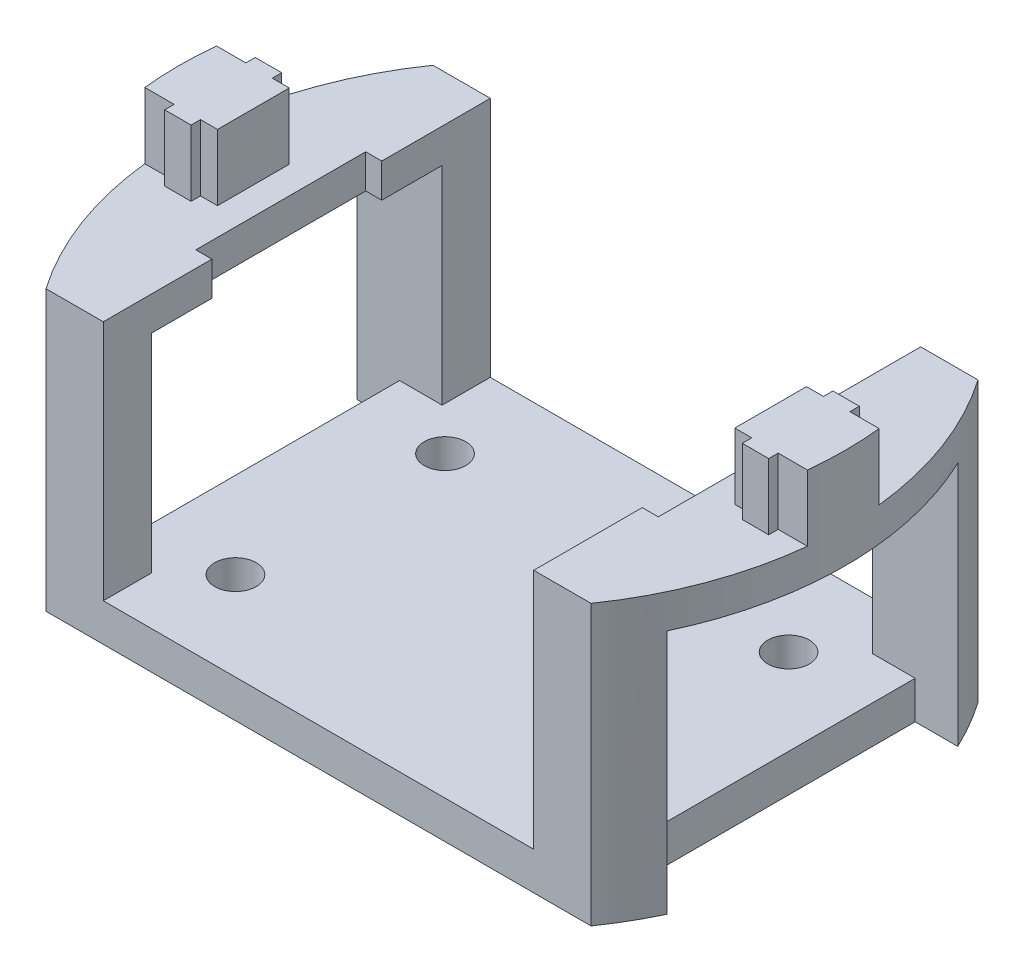
from build123d import *
from build123d.topology import SkipClean

# Parameters (mm, degrees)
SALIENTE_EXTRUIR1_DEPTH           = 14.8
CORTAR_EXTRUIR1_DEPTH             = 25.86366797
CORTAR_EXTRUIR1_DEPTH_BACK        = 25.86366797
CROQUIS2_W                        = 15.4
CROQUIS2_H                        = 11
CORTAR_EXTRUIR2_REACH             = 26.864
CORTAR_EXTRUIR2_DIRECTION_2_DEPTH = 25.86366797
SALIENTE_EXTRUIR2_DEPTH           = 3.5
CROQUIS5_R                        = 1.1
CORTAR_EXTRUIR3_DEPTH             = 26.784723868
CORTAR_EXTRUIR4_DEPTH             = 26.784723868
CROQUIS7_W                        = 27.231493877
CROQUIS7_H                        = 23.409529823
CORTAR_EXTRUIR5_DEPTH             = 28.093393751
CROQUIS8_W                        = 20.5
CROQUIS8_H                        = 2
SALIENTE_EXTRUIR3_DEPTH           = 0.5


with BuildPart() as part:
    # Croquis1 → Saliente-Extruir1 (new body)
    with BuildSketch(Plane(origin=(0, 0, 0), x_dir=(1, 0, 0), z_dir=(0, 1, 0))):
        with BuildLine():
            Line((-13.935, -10.25), (13.935, -10.25))
            ThreePointArc((13.935, -10.25), (17.149328994, 0), (13.935, 10.25))
            Line((13.935, 10.25), (-13.935, 10.25))
            ThreePointArc((-13.935, 10.25), (-17.149328994, 0), (-13.935, -10.25))
        make_face()
    extrude(amount=SALIENTE_EXTRUIR1_DEPTH)

    # Croquis2 → Cortar-Extruir1 (cut, two sides: drawn at the far end of the back side and taken through both)
    with BuildSketch(Plane(origin=(0, 0, 0), x_dir=(0, 0, -1), z_dir=(1, 0, 0)).offset(-CORTAR_EXTRUIR1_DEPTH_BACK)):
        with Locations((0, 7.5)):
            Rectangle(CROQUIS2_W, CROQUIS2_H)
    extrude(amount=CORTAR_EXTRUIR1_DEPTH + CORTAR_EXTRUIR1_DEPTH_BACK, mode=Mode.SUBTRACT)

    # Cortar-Extruir2: up to this face of the body (flat: up to its plane)
    cortar_extruir2_end = Plane(part.part.faces().sort_by_distance((0, 2, 0))[0])
    # Croquis3 → Cortar-Extruir2 (cut, up to the picked face)
    with BuildSketch(Plane(origin=(0, 14.8, 0), x_dir=(1, 0, 0), z_dir=(0, 1, 0)), mode=Mode.PRIVATE) as cortar_extruir2_sk1:
        Polygon((10.9, -10.25), (-10.9, -10.25), (-10.9, -4.5), (-11.75, -4.5), (-11.75, 4.5), (-10.9, 4.5), (-10.9, 10.25), (10.9, 10.25), (10.9, 4.5), (11.75, 4.5), (11.75, -4.5), (10.9, -4.5), align=None)
    cortar_extruir2_tool1 = split(extrude(cortar_extruir2_sk1.sketch, amount=-CORTAR_EXTRUIR2_REACH, mode=Mode.PRIVATE), bisect_by=cortar_extruir2_end, keep=Keep.BOTH, mode=Mode.PRIVATE)
    add(cortar_extruir2_tool1.solids().sort_by(Axis((0, 14.8, 0), (0, -1, 0)))[0], mode=Mode.SUBTRACT)

    # Croquis3 → Cortar-Extruir2 direction 2 (cut)
    with BuildSketch(Plane(origin=(0, 14.8, 0), x_dir=(1, 0, 0), z_dir=(0, 1, 0))):
        Polygon((10.9, -10.25), (-10.9, -10.25), (-10.9, -4.5), (-11.75, -4.5), (-11.75, 4.5), (-10.9, 4.5), (-10.9, 10.25), (10.9, 10.25), (10.9, 4.5), (11.75, 4.5), (11.75, -4.5), (10.9, -4.5), align=None)
    extrude(amount=CORTAR_EXTRUIR2_DIRECTION_2_DEPTH, mode=Mode.SUBTRACT)

    # Croquis4 → Saliente-Extruir2 (add)
    with SkipClean():  # the faces are left unmerged after this step: merging them gives an invalid solid
        with BuildSketch(Plane(origin=(0, 14.8, 0), x_dir=(1, 0, 0), z_dir=(0, 1, 0))):
            with BuildLine():
                Line((-13.2, 1.9), (-13.2, -1.9))
                Line((-13.2, -1.9), (-14.1, -1.9))
                Line((-14.1, -1.9), (-14.1, -2.4))
                Line((-14.1, -2.4), (-15.5, -2.4))
                Line((-15.5, -2.4), (-15.5, -1.9))
                Line((-15.5, -1.9), (-17.048488638, -1.9))
                ThreePointArc((-17.048488638, -1.9), (-17.149328994, 0), (-17.048488638, 1.9))
                Line((-17.048488638, 1.9), (-15.5, 1.9))
                Line((-15.5, 1.9), (-15.5, 2.4))
                Line((-15.5, 2.4), (-14.1, 2.4))
                Line((-14.1, 2.4), (-14.1, 1.9))
                Line((-14.1, 1.9), (-13.2, 1.9))
            make_face()
        saliente_extruir2 = extrude(amount=SALIENTE_EXTRUIR2_DEPTH)

    # Simetría1: Saliente-Extruir2 across plane
    with SkipClean():  # the faces are left unmerged after this step: merging them gives an invalid solid
        add(saliente_extruir2.mirror(Plane(origin=(0, 0, 0), x_dir=(0, 0, 1), z_dir=(1, 0, 0))))

    # Croquis5 → Cortar-Extruir3 (cut, through all)
    with SkipClean():  # the faces are left unmerged after this step: merging them gives an invalid solid
        with BuildSketch(Plane(origin=(0, 2, 0), x_dir=(1, 0, 0), z_dir=(0, 1, 0))):
            with Locations(Location((-8.6, -5.55, 0), (0, 0, 270))):
                Circle(CROQUIS5_R)
            with Locations(Location((-8.6, 5.55, 0), (0, 0, 270))):
                Circle(CROQUIS5_R)
            with Locations(Location((8.6, -5.55, 0), (0, 0, 90))):
                Circle(CROQUIS5_R)
            with Locations(Location((8.6, 5.55, 0), (0, 0, 90))):
                Circle(CROQUIS5_R)
        extrude(amount=-CORTAR_EXTRUIR3_DEPTH, mode=Mode.SUBTRACT)

    # Croquis6 → Cortar-Extruir4 (cut, through all)
    with BuildSketch(Plane(origin=(0, 2, 0), x_dir=(1, 0, 0), z_dir=(0, 1, 0))):
        with BuildLine():
            Line((-13.156952885, 7.7), (-13.156952885, -7.7))
            Line((-13.156952885, -7.7), (-15.413905769, -7.7))
            ThreePointArc((-15.413905769, -7.7), (-17.149328994, 0), (-15.413905769, 7.7))
            Line((-15.413905769, 7.7), (-13.156952885, 7.7))
        make_face()
        with BuildLine():
            Line((13.156952885, 7.7), (13.156952885, -7.7))
            Line((13.156952885, -7.7), (15.413905769, -7.7))
            ThreePointArc((15.413905769, -7.7), (17.149328994, 0), (15.413905769, 7.7))
            Line((15.413905769, 7.7), (13.156952885, 7.7))
        make_face()
    extrude(amount=-CORTAR_EXTRUIR4_DEPTH, mode=Mode.SUBTRACT)

    # Croquis7 → Cortar-Extruir5 (cut, through all)
    with BuildSketch(Plane(origin=(0, 0, 0), x_dir=(0, 0, -1), z_dir=(1, 0, 0))):
        with Locations((0.238872753, 8.562005531)):
            Rectangle(CROQUIS7_W, CROQUIS7_H)
    extrude(amount=-CORTAR_EXTRUIR5_DEPTH, mode=Mode.SUBTRACT)

    # Croquis8 → Saliente-Extruir3 (add)
    with BuildSketch(Plane.ZY):
        with Locations((0, 1)):
            Rectangle(CROQUIS8_W, CROQUIS8_H)
    extrude(amount=SALIENTE_EXTRUIR3_DEPTH)

    # Simetría4: part across plane


with BuildPart() as part_1:
    add(part.part)
    add(part.part.mirror(Plane.ZY.offset(0.5)))


solid = part_1.part
